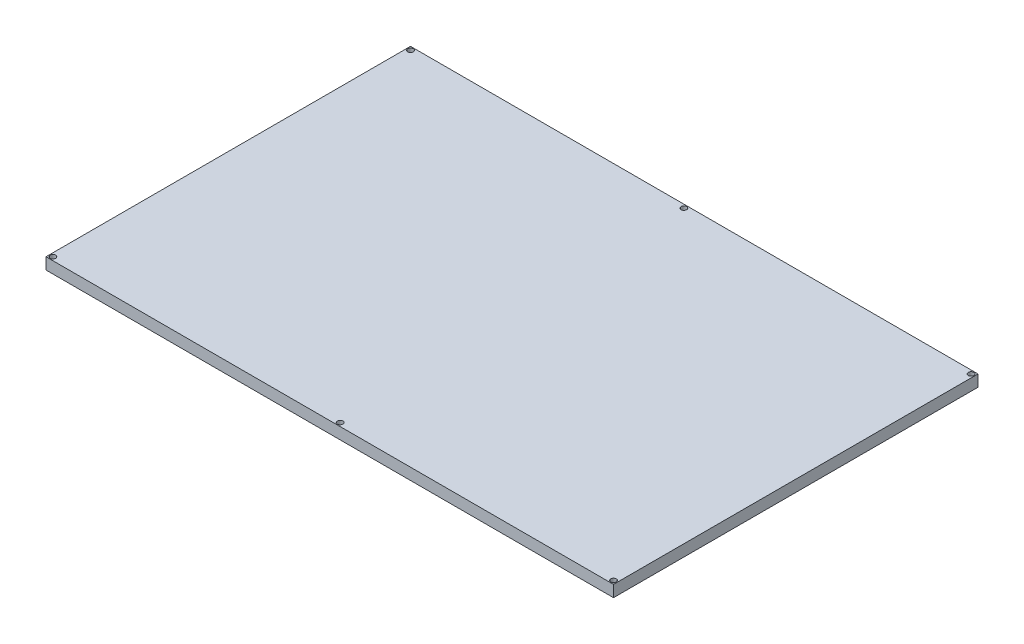
from build123d import *

# Parameters (mm, degrees)
SKETCH1_W            = 246
SKETCH1_H            = 158
BOSS_EXTRUDE1_DEPTH  = 5
M2_CLEARANCE_HOLE1_D = 2.4


with BuildPart() as part:
    # Sketch1 → Boss-Extrude1 (new body)
    with BuildSketch(Plane(origin=(0, 0, 0), x_dir=(1, 0, 0), z_dir=(0, 1, 0))):
        Rectangle(SKETCH1_W, SKETCH1_H)
    extrude(amount=BOSS_EXTRUDE1_DEPTH)

    # M2 Clearance Hole1 (through all)
    with Locations(Plane(origin=(0, 5, 0), x_dir=(1, 0, 0), z_dir=(0, 1, 0))):
        with Locations((-121.5, 77.5), (-3, 77.5), (121.5, 77.5), (121.5, -77.5), (3, -77.5), (-121.5, -77.5)):
            Hole(M2_CLEARANCE_HOLE1_D / 2)


solid = part.part
